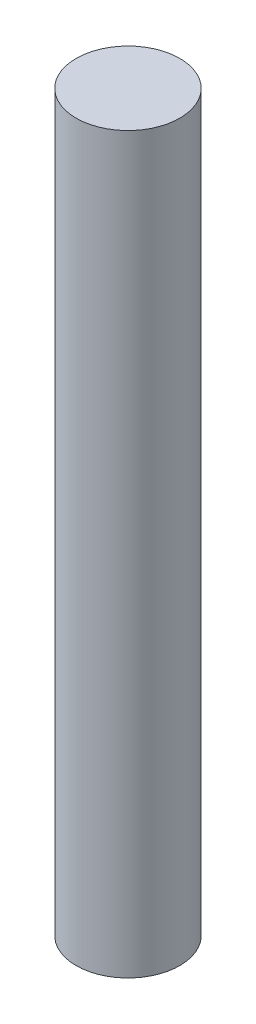
from build123d import *

# Parameters (mm, degrees)
SKETCH2_R           = 2.95
BOSS_EXTRUDE1_DEPTH = 41.8


with BuildPart() as part:
    # Sketch2 → Boss-Extrude1 (new body)
    with BuildSketch(Plane(origin=(0, 0, 0), x_dir=(1, 0, 0), z_dir=(0, 1, 0))):
        Circle(SKETCH2_R)
    extrude(amount=BOSS_EXTRUDE1_DEPTH)


solid = part.part
